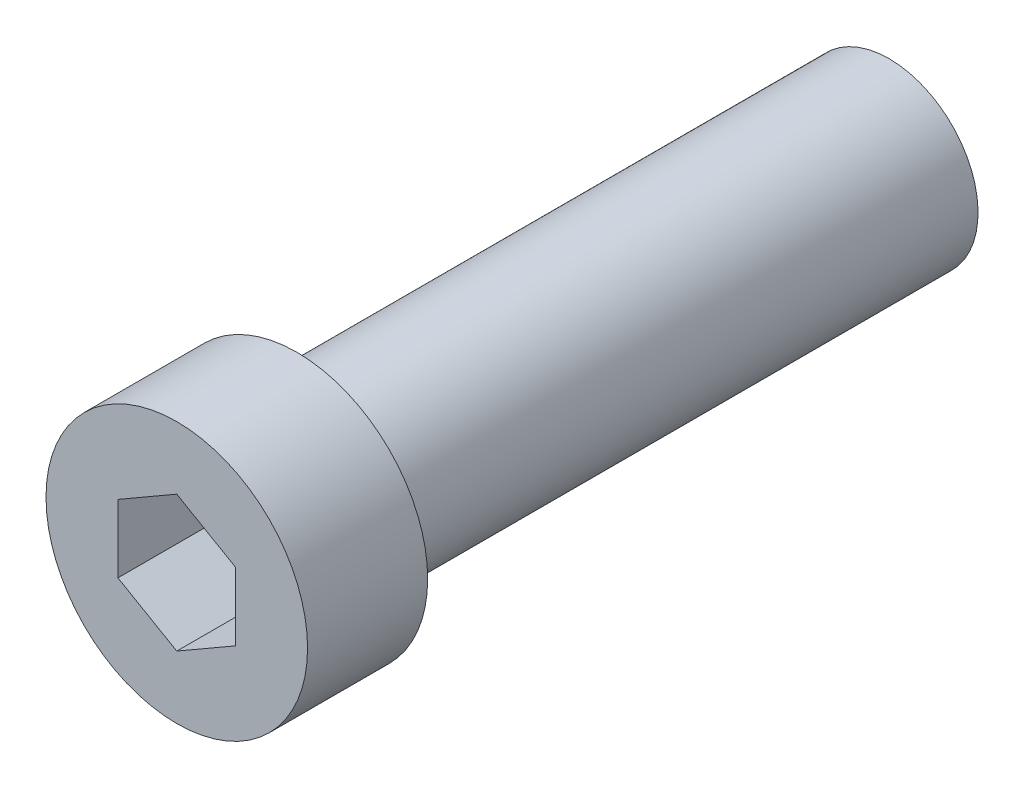
from build123d import *

# Parameters (mm, degrees)
SKETCH_1_W          = 2.208
SKETCH_1_H          = 2.028
SKETCH_2_R          = 1.5
EXTRUDE_1_DEPTH     = 10
CUT_EXTRUDE_1_DEPTH = 1.872


with BuildPart() as part:
    # 草图1 → 旋转1 (revolve)
    with BuildSketch(Plane.XZ, mode=Mode.PRIVATE) as revolve_1_sk:
        with Locations((1.104, 1.014)):
            Rectangle(SKETCH_1_W, SKETCH_1_H)
    revolve(revolve_1_sk.sketch.rotate(Axis((0, 0, 2.028), (0, 0, -1)), 270), axis=Axis((0, 0, 2.028), (0, 0, -1)))

    # 草图2 → 凸台-拉伸1 (add)
    with BuildSketch(Plane(origin=(0, 0, 0), x_dir=(-1, 0, 0), z_dir=(0, 0, -1))):
        with Locations(Location((0, 0, 0), (0, 0, 90))):
            Circle(SKETCH_2_R)
    extrude(amount=EXTRUDE_1_DEPTH)

    # 草图3 → 切除-拉伸1 (cut)
    with BuildSketch(Plane.XY.offset(2.028)):
        Polygon((0.9936, -0.573655227), (0.9936, 0.573655227), (0, 1.147310455), (-0.9936, 0.573655227), (-0.9936, -0.573655227), (0, -1.147310455), align=None)
    extrude(amount=-CUT_EXTRUDE_1_DEPTH, mode=Mode.SUBTRACT)


solid = part.part
